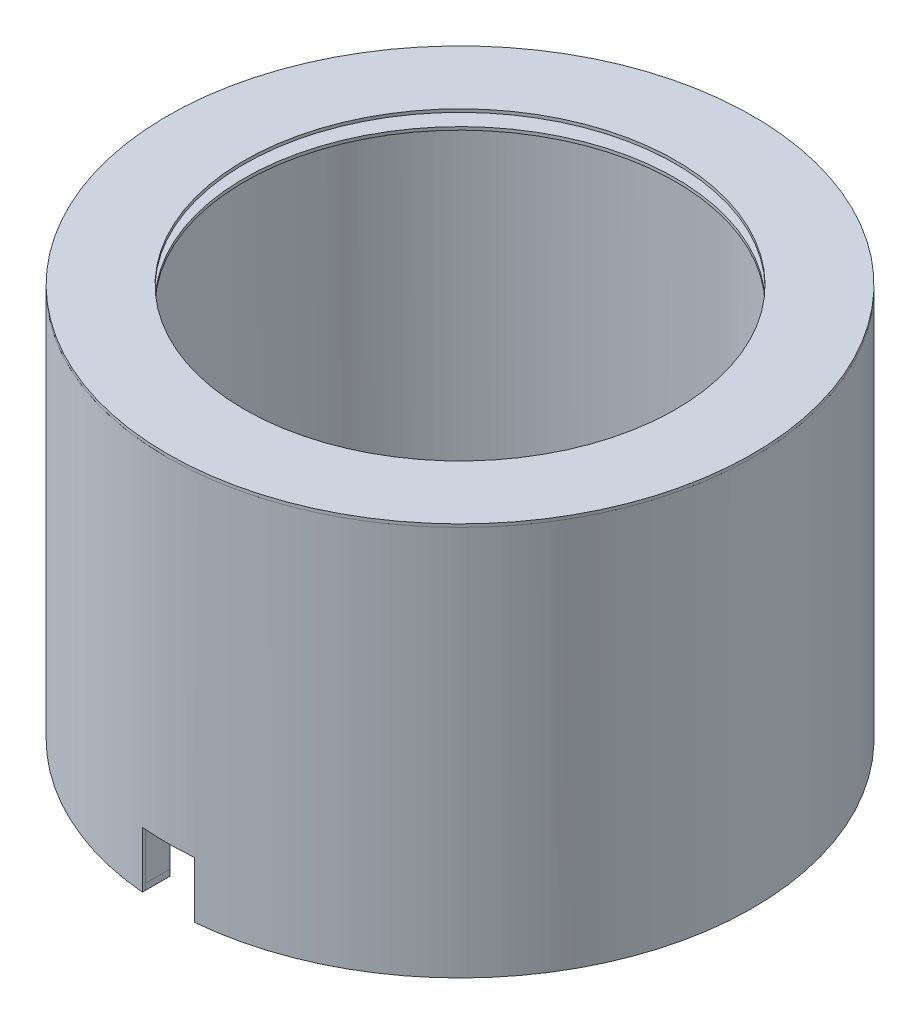
from build123d import *

# Parameters (mm, degrees)
SKETCH1_R           = 237.5
SKETCH1_R_2         = 235
BOSS_EXTRUDE1_DEPTH = 316.6
SKETCH3_R           = 235
SKETCH3_R_2         = 215
BOSS_EXTRUDE2_DEPTH = 5
SKETCH7_R           = 237.5
SKETCH7_R_2         = 175
BOSS_EXTRUDE3_DEPTH = 2.5
SKETCH8_R           = 235
SKETCH8_R_2         = 175
BOSS_EXTRUDE4_DEPTH = 2.5
SKETCH9_R           = 235
BOSS_EXTRUDE5_DEPTH = 299.1
CUT_EXTRUDE5_REACH  = 621.561
SKETCH5_W           = 42.50000009
SKETCH5_H           = 45.600000066


with BuildPart() as part:
    # Sketch1 → Boss-Extrude1 (new body)
    with BuildSketch(Plane(origin=(0, 0, 0), x_dir=(1, 0, 0), z_dir=(0, 1, 0))):
        with Locations(Location((0, 0, 0), (0, 0, 270))):
            Circle(SKETCH1_R)
        with Locations(Location((0, 0, 0), (0, 0, 270))):
            Circle(SKETCH1_R_2, mode=Mode.SUBTRACT)
    extrude(amount=BOSS_EXTRUDE1_DEPTH)


with BuildPart() as body_2:
    # Sketch3 → Boss-Extrude2 (new body)
    with BuildSketch(Plane(origin=(0, 0, 0), x_dir=(1, 0, 0), z_dir=(0, 1, 0))):
        with Locations(Location((0, 0, 0), (0, 0, 270))):
            Circle(SKETCH3_R)
        with Locations(Location((0, 0, 0), (0, 0, 270))):
            Circle(SKETCH3_R_2, mode=Mode.SUBTRACT)
    extrude(amount=BOSS_EXTRUDE2_DEPTH)


with BuildPart() as body_3:
    # Sketch7 → Boss-Extrude3 (new body)
    with BuildSketch(Plane(origin=(0, 316.6, 0), x_dir=(1, 0, 0), z_dir=(0, 1, 0))):
        with Locations(Location((0, 0, 0), (0, 0, 270))):
            Circle(SKETCH7_R)
        with Locations(Location((0, 0, 0), (0, 0, 270))):
            Circle(SKETCH7_R_2, mode=Mode.SUBTRACT)
    extrude(amount=BOSS_EXTRUDE3_DEPTH)


with BuildPart() as body_4:
    # Sketch8 → Boss-Extrude4 (new body)
    with BuildSketch(Plane(origin=(0, 306.6, 0), x_dir=(1, 0, 0), z_dir=(0, 1, 0))):
        with Locations(Location((0, 0, 0), (0, 0, 270))):
            Circle(SKETCH8_R)
        with Locations(Location((0, 0, 0), (0, 0, 270))):
            Circle(SKETCH8_R_2, mode=Mode.SUBTRACT)
    extrude(amount=-BOSS_EXTRUDE4_DEPTH)


with BuildPart() as body_5:
    # Sketch9 → Boss-Extrude5 (new body)
    with BuildSketch(Plane(origin=(0, 5, 0), x_dir=(1, 0, 0), z_dir=(0, 1, 0))):
        with Locations(Location((0, 0, 0), (0, 0, 270))):
            Circle(SKETCH9_R)
    extrude(amount=BOSS_EXTRUDE5_DEPTH)

    # Sketch13 → Cut-Revolve2 (revolve, cut)
    with BuildSketch(Plane.XY, mode=Mode.PRIVATE) as cut_revolve2_sk:
        Polygon((0, 5), (-215, 5), (-220, 304.1), (0, 304.1), align=None)
    revolve(cut_revolve2_sk.sketch.rotate(Axis((0, 5, 0), (0, 1, 0)), 270), axis=Axis((0, 5, 0), (0, 1, 0)), mode=Mode.SUBTRACT)


with BuildPart() as cut_extrude5_tool:
    # Cut-Extrude5: up to this cone (the profile starts outside it)
    cut_extrude5_end = Plane(origin=(0, 22.8, 0), z_dir=(0, 1, 0)) * Cone(201.299589446, 229.295529243, 1674.717118689, mode=Mode.PRIVATE)
    # Sketch5 → Cut-Extrude5 (new, up to the surface)
    with BuildSketch(Plane.XY.offset(237.5), mode=Mode.PRIVATE) as cut_extrude5_sk1:
        with Locations((0, 22.800000033)):
            Rectangle(SKETCH5_W, SKETCH5_H)
    cut_extrude5_tool1 = extrude(cut_extrude5_sk1.sketch, amount=-CUT_EXTRUDE5_REACH, mode=Mode.PRIVATE) - cut_extrude5_end
    add(cut_extrude5_tool1.solids().sort_by_distance((0, 22.8, 237.5))[0])


with BuildPart() as part_1:
    add(part.part)

    # Cut-Extrude5: cut by cut_extrude5_tool
    add(cut_extrude5_tool.part, mode=Mode.SUBTRACT)


with BuildPart() as body_2_1:
    add(body_2.part)

    # Cut-Extrude5: cut by cut_extrude5_tool
    add(cut_extrude5_tool.part, mode=Mode.SUBTRACT)


with BuildPart() as body_5_1:
    add(body_5.part)

    # Cut-Extrude5: cut by cut_extrude5_tool
    add(cut_extrude5_tool.part, mode=Mode.SUBTRACT)


solid = Compound([body_3.part, body_4.part, part_1.part, body_2_1.part, body_5_1.part])
